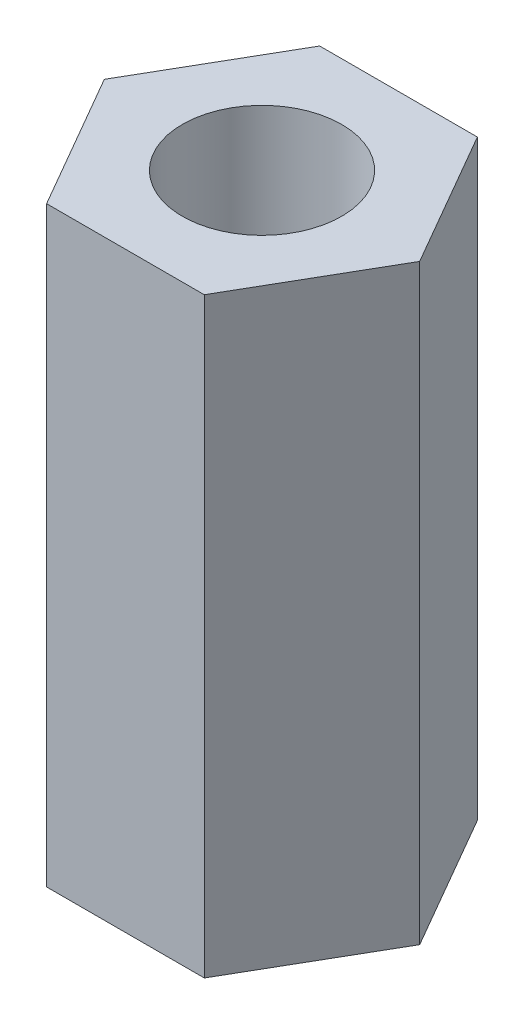
from build123d import *

# Parameters (mm, degrees)
ESQUISSE1_R        = 1.75
BOSS_EXTRU_1_DEPTH = 13


with BuildPart() as part:
    # Esquisse1 → Boss.-Extru.1 (new body)
    with BuildSketch(Plane(origin=(0, 0, 0), x_dir=(1, 0, 0), z_dir=(0, 1, 0))):
        Polygon((3.464101615, 0), (1.732050808, 3), (-1.732050808, 3), (-3.464101615, 0), (-1.732050808, -3), (1.732050808, -3), align=None)
        with Locations(Location((0, 0, 0), (0, 0, 90))):
            Circle(ESQUISSE1_R, mode=Mode.SUBTRACT)
    extrude(amount=BOSS_EXTRU_1_DEPTH)


solid = part.part
